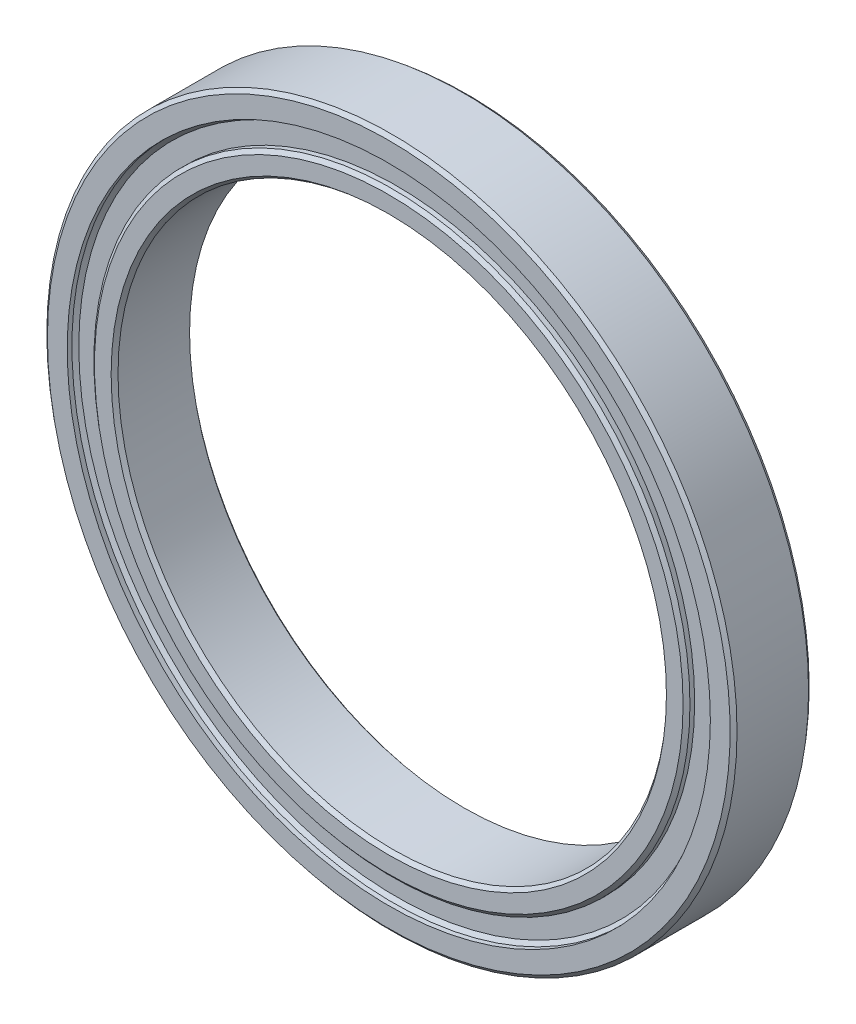
from build123d import *
from OCP.BRepFilletAPI import BRepFilletAPI_MakeChamfer

# Parameters (mm, degrees)
SKETCH_1_R          = 22
SKETCH_1_R_2        = 17.5
EXTRUDE_1_DEPTH     = 5
SKETCH_2_R          = 20.5
SKETCH_2_R_2        = 19
CUT_EXTRUDE_1_DEPTH = 0.5
CHAMFER_1_SIZE      = 0.2
CHAMFER_1_SIZE2     = 0.238350719
CHAMFER_2_SIZE      = 0.2
CHAMFER_2_SIZE2     = 0.238350719


with BuildPart() as part:
    # 草图1 → 凸台-拉伸1 (new body)
    with BuildSketch(Plane.XY):
        Circle(SKETCH_1_R)
        Circle(SKETCH_1_R_2, mode=Mode.SUBTRACT)
    extrude(amount=EXTRUDE_1_DEPTH)

    # 草图2 → 切除-拉伸1 (cut)
    with BuildSketch(Plane.XY.offset(5)):
        Circle(SKETCH_2_R)
        Circle(SKETCH_2_R_2, mode=Mode.SUBTRACT)
    cut_extrude_1 = extrude(amount=-CUT_EXTRUDE_1_DEPTH, mode=Mode.SUBTRACT)

    # 倒角1: one chamfer whose edges measure the first distance from different faces: ONE call of the kernel's chamfer builder (chamfer() names one face for all edges)
    chamfer_1_edges_1 = [part.edges().sort_by_distance(p)[0] for p in [
        (-20.5, 0, 4.5),
    ]]
    chamfer_1_side_1 = [part.faces().sort_by_distance(p)[0] for p in [
        (-20.5, 0, 4.75),
    ]]
    chamfer_1_edges_2 = [part.edges().sort_by_distance(p)[0] for p in [
        (-19, 0, 5),
    ]]
    chamfer_1_side_2 = [part.faces().sort_by_distance(p)[0] for p in [
        (-19, 0, 4.75),
    ]]
    chamfer_1_edges_3 = [part.edges().sort_by_distance(p)[0] for p in [
        (-22, 0, 5),
    ]]
    chamfer_1_side_3 = [part.faces().sort_by_distance(p)[0] for p in [
        (-22, 0, 2.5),
    ]]
    chamfer_1_edges_4 = [part.edges().sort_by_distance(p)[0] for p in [
        (-17.5, 0, 5),
    ]]
    chamfer_1_side_4 = [part.faces().sort_by_distance(p)[0] for p in [
        (-18.462598846, 0, 5),
    ]]
    chamfer_1 = BRepFilletAPI_MakeChamfer(part.part.solid().wrapped)
    for e in chamfer_1_edges_1:
        chamfer_1.Add(CHAMFER_1_SIZE, CHAMFER_1_SIZE2, e.wrapped, chamfer_1_side_1[0].wrapped)  # the first distance lies on this face
    for e in chamfer_1_edges_2:
        chamfer_1.Add(CHAMFER_1_SIZE, CHAMFER_1_SIZE2, e.wrapped, chamfer_1_side_2[0].wrapped)  # the first distance lies on this face
    for e in chamfer_1_edges_3:
        chamfer_1.Add(CHAMFER_1_SIZE, CHAMFER_1_SIZE2, e.wrapped, chamfer_1_side_3[0].wrapped)  # the first distance lies on this face
    for e in chamfer_1_edges_4:
        chamfer_1.Add(CHAMFER_1_SIZE, CHAMFER_1_SIZE2, e.wrapped, chamfer_1_side_4[0].wrapped)  # the first distance lies on this face
    add(Compound.cast(chamfer_1.Shape()), mode=Mode.REPLACE)

    # 镜向1: 切除-拉伸1 across plane
    add(cut_extrude_1.mirror(Plane.XY.offset(2.5)), mode=Mode.SUBTRACT)

    # 倒角2: one chamfer whose edges measure the first distance from different faces: ONE call of the kernel's chamfer builder (chamfer() names one face for all edges)
    chamfer_2_edges_1 = [part.edges().sort_by_distance(p)[0] for p in [
        (-22, 0, 0),
    ]]
    chamfer_2_side_1 = [part.faces().sort_by_distance(p)[0] for p in [
        (-21.377746033, 0, 0),
    ]]
    chamfer_2_edges_2 = [part.edges().sort_by_distance(p)[0] for p in [
        (-19, 0, 0),
    ]]
    chamfer_2_side_2 = [part.faces().sort_by_distance(p)[0] for p in [
        (-18.462598846, 0, 0),
    ]]
    chamfer_2_edges_3 = [part.edges().sort_by_distance(p)[0] for p in [
        (-20.5, 0, 0),
    ]]
    chamfer_2_side_3 = [part.faces().sort_by_distance(p)[0] for p in [
        (-20.5, 0, 0.25),
    ]]
    chamfer_2_edges_4 = [part.edges().sort_by_distance(p)[0] for p in [
        (-17.5, 0, 0),
    ]]
    chamfer_2_side_4 = [part.faces().sort_by_distance(p)[0] for p in [
        (-17.5, 0, 2.380824641),
    ]]
    chamfer_2 = BRepFilletAPI_MakeChamfer(part.part.solid().wrapped)
    for e in chamfer_2_edges_1:
        chamfer_2.Add(CHAMFER_2_SIZE, CHAMFER_2_SIZE2, e.wrapped, chamfer_2_side_1[0].wrapped)  # the first distance lies on this face
    for e in chamfer_2_edges_2:
        chamfer_2.Add(CHAMFER_2_SIZE, CHAMFER_2_SIZE2, e.wrapped, chamfer_2_side_2[0].wrapped)  # the first distance lies on this face
    for e in chamfer_2_edges_3:
        chamfer_2.Add(CHAMFER_2_SIZE, CHAMFER_2_SIZE2, e.wrapped, chamfer_2_side_3[0].wrapped)  # the first distance lies on this face
    for e in chamfer_2_edges_4:
        chamfer_2.Add(CHAMFER_2_SIZE, CHAMFER_2_SIZE2, e.wrapped, chamfer_2_side_4[0].wrapped)  # the first distance lies on this face
    add(Compound.cast(chamfer_2.Shape()), mode=Mode.REPLACE)


solid = part.part
